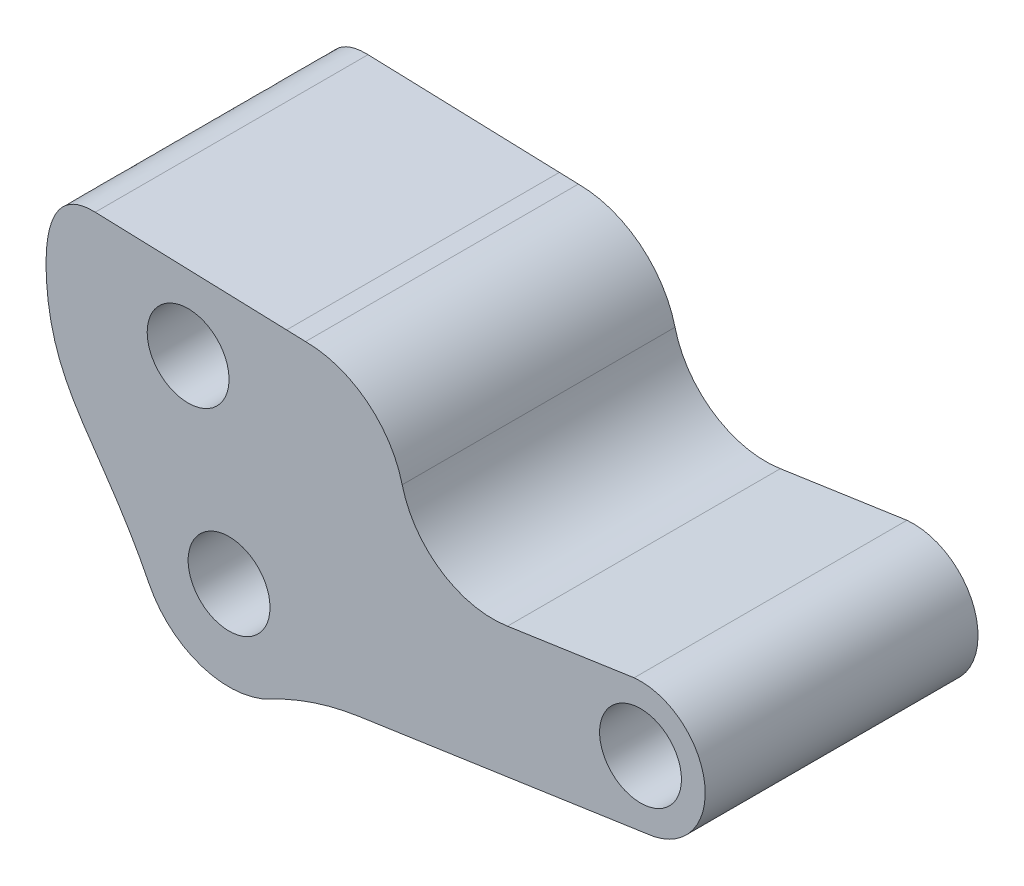
from build123d import *

# Parameters (mm, degrees)
ESQUISSE1_R             = 1.5
BOSS_EXTRU_1_DEPTH      = 10
ESQUISSE4_R             = 1.5
ENL_V_MAT_EXTRU_1_DEPTH = 10


with BuildPart() as part:
    # Esquisse1 → Boss.-Extru.1 (new body)
    with BuildSketch(Plane.XY):
        with BuildLine():
            ThreePointArc((166.196116566, 145.931525385), (166.155979782, 145.925380319), (166.115772908, 145.919711933))
            ThreePointArc((166.115772908, 145.919711933), (163.733808584, 146.481340732), (162.336090633, 148.490212425))
            ThreePointArc((162.336090633, 148.490212425), (161.043135484, 150.488209055), (158.793350908, 151.264219956))
            add(Edge.make_bspline(
                [(158.097461395, 151.287034218), (158.325870367, 151.272612558), (158.557802913, 151.264219956), (158.793350908, 151.264219956)],
                knots=[0.972871192, 0.972871192, 0.972871192, 0.972871192, 1, 1, 1, 1], degree=3))
            Line((158.097461395, 151.287034218), (151.083645878, 151.516977361))
            add(Edge.make_bspline(
                [(151.083645878, 151.516977361), (149.342529168, 151.574058681), (148.84170313, 145.368566224), (151.28409597, 144.26310725), (153.059001839, 140.708421316)],
                knots=[0, 0, 0, 0, 0.305758731, 1, 1, 1, 1], degree=3))
            ThreePointArc((153.059001839, 140.708421316), (154.992982473, 139.051339554), (157.529461725, 139.280411726))
            ThreePointArc((157.529461725, 139.280411726), (159.106326045, 139.953593423), (160.77500835, 140.347514793))
            Line((160.77500835, 140.347514793), (171.304889346, 141.895791964))
            ThreePointArc((171.304889346, 141.895791964), (173.430316642, 144.488558391), (170.837550215, 146.613985687))
            Line((170.837550215, 146.613985687), (166.196116566, 145.931525385))
        make_face()
        with Locations((155.989754872, 142.171788504)):
            Circle(ESQUISSE1_R, mode=Mode.SUBTRACT)
        with Locations((171.07121978, 144.254888826)):
            Circle(ESQUISSE1_R, mode=Mode.SUBTRACT)
    extrude(amount=BOSS_EXTRU_1_DEPTH)

    # Esquisse4 → Enlèv. mat.-Extru.1 (cut)
    with BuildSketch(Plane(origin=(0, 0, 0), x_dir=(-1, 0, 0), z_dir=(0, 0, -1))):
        with Locations((-154.488550327, 148.660392739)):
            Circle(ESQUISSE4_R)
    extrude(amount=-ENL_V_MAT_EXTRU_1_DEPTH, mode=Mode.SUBTRACT)


solid = part.part
